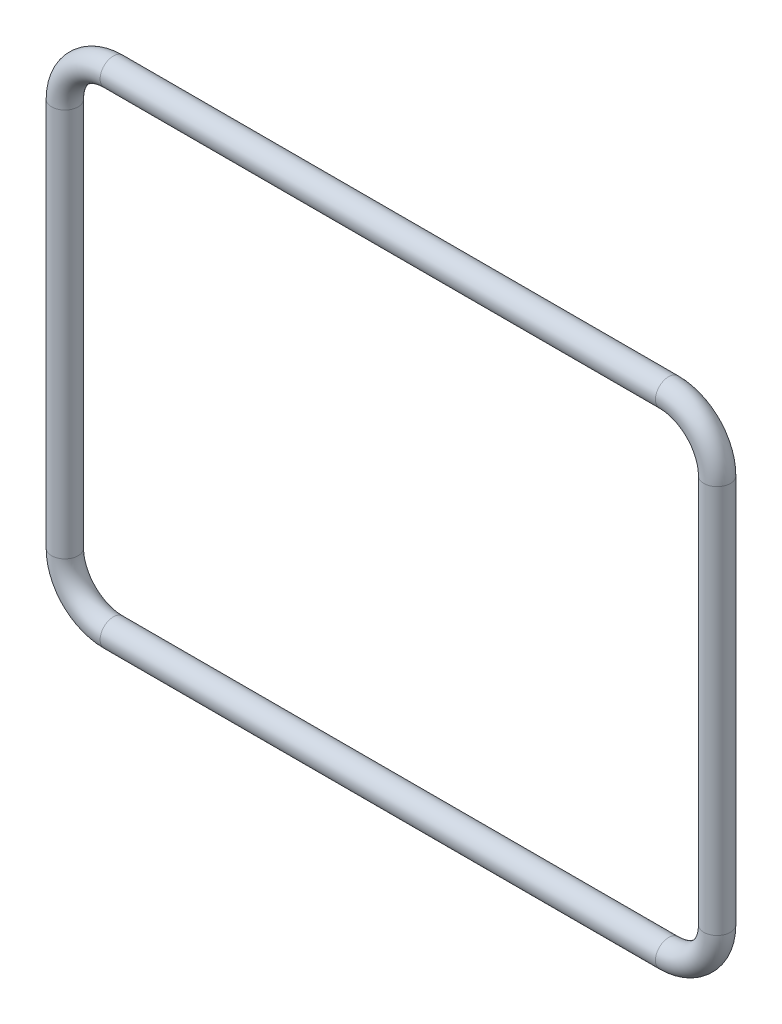
from build123d import *

# Parameters (mm, degrees)
ESBO_O4_R = 4.7625


with BuildPart() as part:
    # Varredura1: sweep along a path in Esboço1
    with BuildLine(Plane.XY) as varredura1_path:
        Line((-200, 157.4625), (0, 157.4625))
        ThreePointArc((0, 157.4625), (12.347852166, 152.347852166), (17.4625, 140))
        Line((17.4625, 140), (17.4625, 0))
        ThreePointArc((17.4625, 0), (12.347852166, -12.347852166), (0, -17.4625))
        Line((0, -17.4625), (-200, -17.4625))
        ThreePointArc((-200, -17.4625), (-212.347852166, -12.347852166), (-217.4625, 0))
        Line((-217.4625, 0), (-217.4625, 140))
        ThreePointArc((-217.4625, 140), (-212.347852166, 152.347852166), (-200, 157.4625))
    # Esboço4 → Varredura1 (sweep)
    with BuildSketch(Plane(origin=(-200, 0, 0), x_dir=(0, 0, -1), z_dir=(1, 0, 0))):
        with Locations((0, 157.4625)):
            Circle(ESBO_O4_R)
    sweep(path=varredura1_path.line)


solid = part.part
